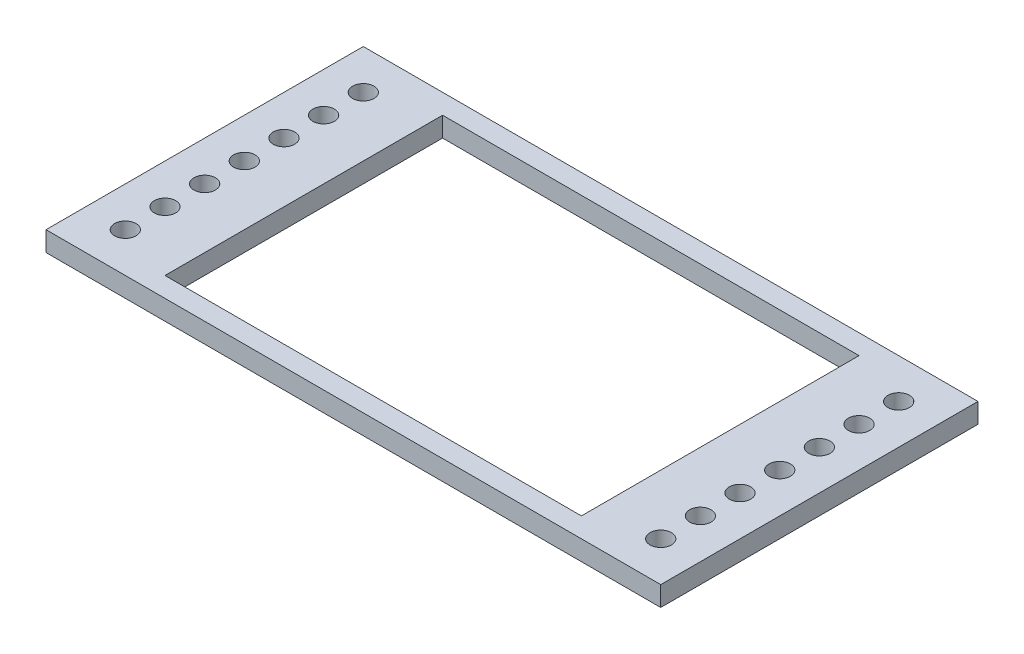
from build123d import *

# Parameters (mm, degrees)
SKETCH1_W           = 196.85
SKETCH1_H           = 101.6
SKETCH1_R           = 3.429
SKETCH1_W_2         = 133.35
SKETCH1_H_2         = 88.9
BOSS_EXTRUDE1_DEPTH = 6.35


with BuildPart() as part:
    # Sketch1 → Boss-Extrude1 (new body)
    with BuildSketch(Plane(origin=(0, 0, 0), x_dir=(1, 0, 0), z_dir=(0, 1, 0))):
        Rectangle(SKETCH1_W, SKETCH1_H)
        with Locations(Location((-85.725, 38.1, 0), (0, 0, 270))):
            Circle(SKETCH1_R, mode=Mode.SUBTRACT)
        with Locations(Location((85.725, 38.1, 0), (0, 0, 270))):
            Circle(SKETCH1_R, mode=Mode.SUBTRACT)
        with Locations(Location((85.725, 25.4, 0), (0, 0, 270))):
            Circle(SKETCH1_R, mode=Mode.SUBTRACT)
        with Locations(Location((85.725, 12.7, 0), (0, 0, 270))):
            Circle(SKETCH1_R, mode=Mode.SUBTRACT)
        with Locations(Location((85.725, 0, 0), (0, 0, 270))):
            Circle(SKETCH1_R, mode=Mode.SUBTRACT)
        with Locations(Location((85.725, -12.7, 0), (0, 0, 270))):
            Circle(SKETCH1_R, mode=Mode.SUBTRACT)
        with Locations(Location((85.725, -25.4, 0), (0, 0, 270))):
            Circle(SKETCH1_R, mode=Mode.SUBTRACT)
        with Locations(Location((85.725, -38.1, 0), (0, 0, 270))):
            Circle(SKETCH1_R, mode=Mode.SUBTRACT)
        with Locations(Location((-85.725, 25.4, 0), (0, 0, 270))):
            Circle(SKETCH1_R, mode=Mode.SUBTRACT)
        with Locations(Location((-85.725, 12.7, 0), (0, 0, 270))):
            Circle(SKETCH1_R, mode=Mode.SUBTRACT)
        with Locations(Location((-85.725, 0, 0), (0, 0, 270))):
            Circle(SKETCH1_R, mode=Mode.SUBTRACT)
        with Locations(Location((-85.725, -12.7, 0), (0, 0, 270))):
            Circle(SKETCH1_R, mode=Mode.SUBTRACT)
        with Locations(Location((-85.725, -25.4, 0), (0, 0, 270))):
            Circle(SKETCH1_R, mode=Mode.SUBTRACT)
        with Locations(Location((-85.725, -38.1, 0), (0, 0, 270))):
            Circle(SKETCH1_R, mode=Mode.SUBTRACT)
        Rectangle(SKETCH1_W_2, SKETCH1_H_2, mode=Mode.SUBTRACT)
    extrude(amount=BOSS_EXTRUDE1_DEPTH)


solid = part.part
